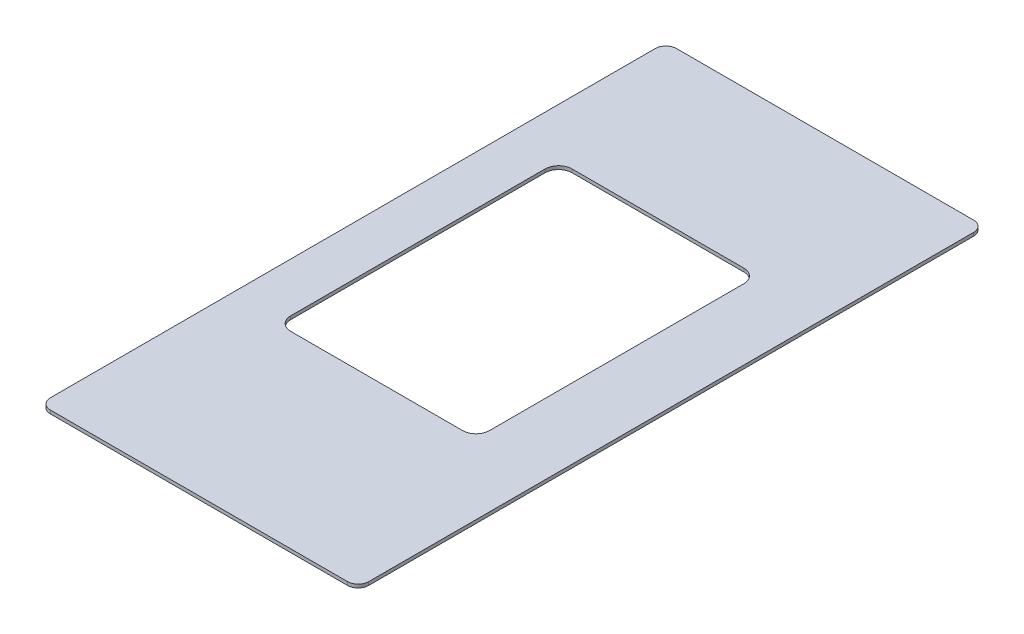
from build123d import *

# Parameters (mm, degrees)
SKETCH9_W           = 300
SKETCH9_H           = 590
SKETCH9_W_2         = 187.325
SKETCH9_H_2         = 265.1125
BOSS_EXTRUDE7_DEPTH = 3.175
FILLET4_R           = 10
FILLET5_R           = 12.7


with BuildPart() as part:
    # Sketch9 → Boss-Extrude7 (new body)
    with BuildSketch(Plane(origin=(0, 0, 0), x_dir=(1, 0, 0), z_dir=(0, 1, 0))):
        with Locations((0, 275)):
            Rectangle(SKETCH9_W, SKETCH9_H)
        with Locations((-10, 290)):
            Rectangle(SKETCH9_W_2, SKETCH9_H_2, mode=Mode.SUBTRACT)
    extrude(amount=BOSS_EXTRUDE7_DEPTH)

    # Fillet4
    fillet4_edges = [part.edges().sort_by_distance(p)[0] for p in [
        (150, 1.5875, -570),
        (150, 1.5875, 20),
        (-150, 1.5875, 20),
        (-150, 1.5875, -570),
    ]]
    fillet(fillet4_edges, radius=FILLET4_R)

    # Fillet5
    fillet5_edges = [part.edges().sort_by_distance(p)[0] for p in [
        (83.6625, 1.5875, -157.44375),
        (83.6625, 1.5875, -422.55625),
        (-103.6625, 1.5875, -422.55625),
        (-103.6625, 1.5875, -157.44375),
    ]]
    fillet(fillet5_edges, radius=FILLET5_R)


solid = part.part
